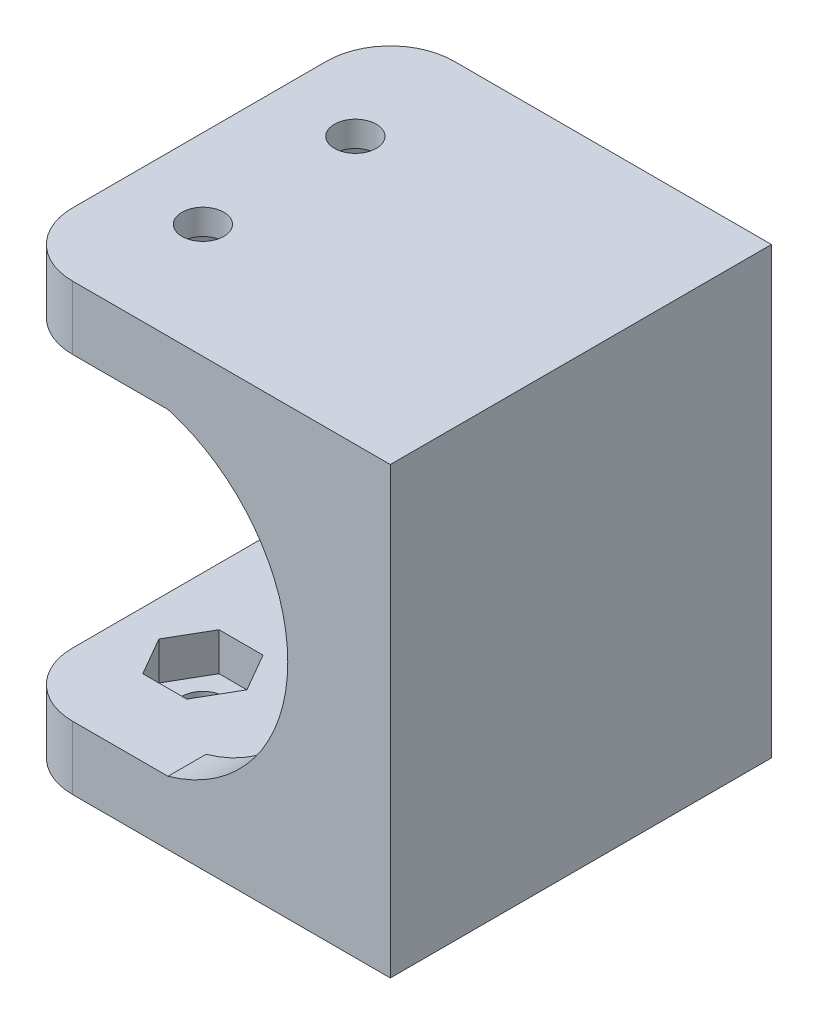
from build123d import *

# Parameters (mm, degrees)
EXTRUDE_1_DEPTH     = 30
EXTRUDE_2_DEPTH     = 3
CUT_EXTRUDE_1_DEPTH = 3
CUT_EXTRUDE_START   = -17
SKETCH_4_R          = 1.65
CUT_EXTRUDE_2_DEPTH = 76
CUT_EXTRUDE_3_DEPTH = 3
FILLET_1_R          = 5


with BuildPart() as part:
    # Эскиз1 → Бобышка-Вытянуть1 (new body)
    with BuildSketch(Plane.XY):
        Polygon((0, 0), (30, 0), (30, 35), (0, 35), (0, 30), (25, 30), (25, 5), (0, 5), align=None)
    extrude(amount=EXTRUDE_1_DEPTH)

    # Эскиз2 → Бобышка-Вытянуть2 (add)
    with BuildSketch(Plane.XY.offset(30)):
        with BuildLine():
            Line((12.5, 30), (25, 30))
            Line((25, 30), (25, 5))
            Line((25, 5), (12.5, 5))
            ThreePointArc((12.5, 5), (21.929285786, 17.5), (12.5, 30))
        make_face()
    extrude_2 = extrude(amount=-EXTRUDE_2_DEPTH)

    # Зеркальное отражение1: Бобышка-Вытянуть2 across plane
    add(extrude_2.mirror(Plane.XY.offset(15)))

    # Эскиз3 → Вырез-Вытянуть1 (cut)
    with BuildSketch(Plane(origin=(0, 5, 0), x_dir=(1, 0, 0), z_dir=(0, 1, 0))):
        Polygon((4.517949192, -24), (2.785898385, -21), (4.517949192, -18), (7.982050808, -18), (9.714101615, -21), (7.982050808, -24), align=None)
        Polygon((2.785898385, -9), (4.517949192, -12), (7.982050808, -12), (9.714101615, -9), (7.982050808, -6), (4.517949192, -6), align=None)
    extrude(amount=-CUT_EXTRUDE_1_DEPTH, mode=Mode.SUBTRACT)

    # Эскиз4 → Вырез-Вытянуть2 (cut)
    with BuildSketch(Plane(origin=(0, 2, 0), x_dir=(1, 0, 0), z_dir=(0, 1, 0)).offset(CUT_EXTRUDE_START)):
        with Locations(Location((6.25, -21, 0), (0, 0, 90))):
            Circle(SKETCH_4_R)
    cut_extrude_2 = extrude(amount=CUT_EXTRUDE_2_DEPTH, mode=Mode.SUBTRACT)

    # Зеркальное отражение2: Вырез-Вытянуть2 across plane
    add(cut_extrude_2.mirror(Plane.XY.offset(15)), mode=Mode.SUBTRACT)

    # Эскиз5 → Вырез-Вытянуть3 (cut)
    with BuildSketch(Plane.XZ.offset(-30)):
        Polygon((9.714101615, 21), (7.982050808, 24), (4.517949192, 24), (2.785898385, 21), (4.517949192, 18), (7.982050808, 18), align=None)
    cut_extrude_3 = extrude(amount=-CUT_EXTRUDE_3_DEPTH, mode=Mode.SUBTRACT)

    # Зеркальное отражение3: Вырез-Вытянуть3 across plane
    add(cut_extrude_3.mirror(Plane.XY.offset(15)), mode=Mode.SUBTRACT)

    # Скругление1
    fillet_1_edges = [part.edges().sort_by_distance(p)[0] for p in [
        (0, 2.5, 0),
        (0, 32.5, 30),
        (0, 2.5, 30),
        (0, 32.5, 0),
    ]]
    fillet(fillet_1_edges, radius=FILLET_1_R)


solid = part.part
